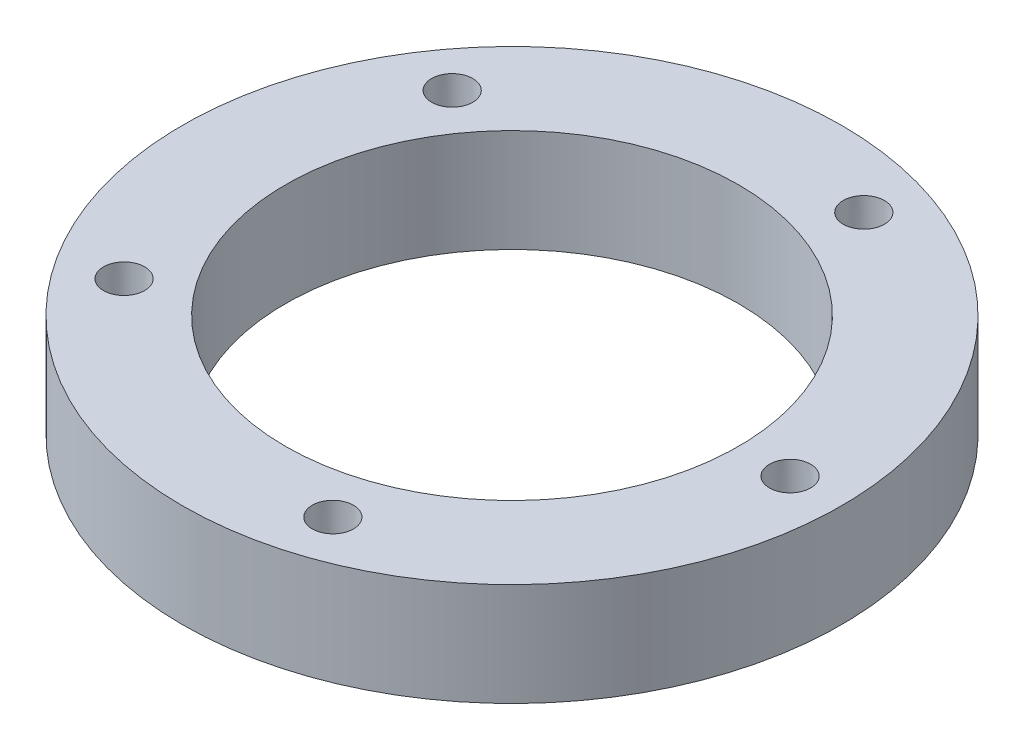
from build123d import *

# Parameters (mm, degrees)
SKETCH1_R                    = 16
SKETCH1_R_2                  = 11
BOSS_EXTRUDE2_DEPTH          = 5
SKETCH2_R                    = 1
CUT_EXTRUDE1_DEPTH           = 5
CUT_EXTRUDE1_DRAFT           = -2
CUT_EXTRUDE1_PROFILE_2_DEPTH = 5
CUT_EXTRUDE1_PROFILE_2_DRAFT = -2
CUT_EXTRUDE1_PROFILE_3_DEPTH = 5
CUT_EXTRUDE1_PROFILE_3_DRAFT = -2
CUT_EXTRUDE1_PROFILE_4_DEPTH = 5
CUT_EXTRUDE1_PROFILE_4_DRAFT = -2
CUT_EXTRUDE1_PROFILE_5_DEPTH = 5
CUT_EXTRUDE1_PROFILE_5_DRAFT = -2


with BuildPart() as part:
    # Sketch1 → Boss-Extrude2 (new body)
    with BuildSketch(Plane(origin=(0, 0, 0), x_dir=(1, 0, 0), z_dir=(0, 1, 0))):
        with Locations(Location((0, 0, 0), (0, 0, 270))):
            Circle(SKETCH1_R)
        with Locations(Location((0, 0, 0), (0, 0, 270))):
            Circle(SKETCH1_R_2, mode=Mode.SUBTRACT)
    extrude(amount=BOSS_EXTRUDE2_DEPTH)


with BuildPart() as cut_extrude1_tool:
    # Sketch2 → Cut-Extrude1 (with draft: the straight prism first)
    with BuildSketch(Plane(origin=(0, 5, 0), x_dir=(1, 0, 0), z_dir=(0, 1, 0))):
        with Locations((-10.918529424, 8.01503688)):
            Circle(SKETCH2_R)
    extrude(amount=-CUT_EXTRUDE1_DEPTH)
    # Cut-Extrude1: the draft: its side faces are tilted about the plane it starts from
    cut_extrude1_sides = [cut_extrude1_tool.faces().sort_by_distance(p)[0] for p in [
        (-11.918529424, 2.5, -8.01503688),
    ]]
    draft(cut_extrude1_sides, Plane(origin=(0, 5, 0), x_dir=(1, 0, 0), z_dir=(0, 1, 0)), CUT_EXTRUDE1_DRAFT)


with BuildPart() as part_1:
    add(part.part)

    # Cut-Extrude1: cut by cut_extrude1_tool
    add(cut_extrude1_tool.part, mode=Mode.SUBTRACT)


with BuildPart() as cut_extrude1_profile_2_tool:
    # Sketch2 → Cut-Extrude1 profile 2 (with draft: the straight prism first)
    with BuildSketch(Plane(origin=(0, 5, 0), x_dir=(1, 0, 0), z_dir=(0, 1, 0))):
        with Locations((-10.966125757, -7.868550431)):
            Circle(SKETCH2_R)
    extrude(amount=-CUT_EXTRUDE1_PROFILE_2_DEPTH)
    # Cut-Extrude1 profile 2: the draft: its side faces are tilted about the plane it starts from
    cut_extrude1_profile_2_sides = [cut_extrude1_profile_2_tool.faces().sort_by_distance(p)[0] for p in [
        (-11.966125757, 2.5, 7.868550431),
    ]]
    draft(cut_extrude1_profile_2_sides, Plane(origin=(0, 5, 0), x_dir=(1, 0, 0), z_dir=(0, 1, 0)), CUT_EXTRUDE1_PROFILE_2_DRAFT)


with BuildPart() as part_2:
    add(part_1.part)

    # Cut-Extrude1 profile 2: cut by cut_extrude1_profile_2_tool
    add(cut_extrude1_profile_2_tool.part, mode=Mode.SUBTRACT)


with BuildPart() as cut_extrude1_profile_3_tool:
    # Sketch2 → Cut-Extrude1 profile 3 (with draft: the straight prism first)
    with BuildSketch(Plane(origin=(0, 5, 0), x_dir=(1, 0, 0), z_dir=(0, 1, 0))):
        with Locations((4.125355383, -12.822115645)):
            Circle(SKETCH2_R)
    extrude(amount=-CUT_EXTRUDE1_PROFILE_3_DEPTH)
    # Cut-Extrude1 profile 3: the draft: its side faces are tilted about the plane it starts from
    cut_extrude1_profile_3_sides = [cut_extrude1_profile_3_tool.faces().sort_by_distance(p)[0] for p in [
        (3.125355383, 2.5, 12.822115645),
    ]]
    draft(cut_extrude1_profile_3_sides, Plane(origin=(0, 5, 0), x_dir=(1, 0, 0), z_dir=(0, 1, 0)), CUT_EXTRUDE1_PROFILE_3_DRAFT)


with BuildPart() as part_3:
    add(part_2.part)

    # Cut-Extrude1 profile 3: cut by cut_extrude1_profile_3_tool
    add(cut_extrude1_profile_3_tool.part, mode=Mode.SUBTRACT)


with BuildPart() as cut_extrude1_profile_4_tool:
    # Sketch2 → Cut-Extrude1 profile 4 (with draft: the straight prism first)
    with BuildSketch(Plane(origin=(0, 5, 0), x_dir=(1, 0, 0), z_dir=(0, 1, 0))):
        with Locations((13.5, 0)):
            Circle(SKETCH2_R)
    extrude(amount=-CUT_EXTRUDE1_PROFILE_4_DEPTH)
    # Cut-Extrude1 profile 4: the draft: its side faces are tilted about the plane it starts from
    cut_extrude1_profile_4_sides = [cut_extrude1_profile_4_tool.faces().sort_by_distance(p)[0] for p in [
        (12.5, 2.5, 0),
    ]]
    draft(cut_extrude1_profile_4_sides, Plane(origin=(0, 5, 0), x_dir=(1, 0, 0), z_dir=(0, 1, 0)), CUT_EXTRUDE1_PROFILE_4_DRAFT)


with BuildPart() as part_4:
    add(part_3.part)

    # Cut-Extrude1 profile 4: cut by cut_extrude1_profile_4_tool
    add(cut_extrude1_profile_4_tool.part, mode=Mode.SUBTRACT)


with BuildPart() as cut_extrude1_profile_5_tool:
    # Sketch2 → Cut-Extrude1 profile 5 (with draft: the straight prism first)
    with BuildSketch(Plane(origin=(0, 5, 0), x_dir=(1, 0, 0), z_dir=(0, 1, 0))):
        with Locations((4.202367867, 12.878068489)):
            Circle(SKETCH2_R)
    extrude(amount=-CUT_EXTRUDE1_PROFILE_5_DEPTH)
    # Cut-Extrude1 profile 5: the draft: its side faces are tilted about the plane it starts from
    cut_extrude1_profile_5_sides = [cut_extrude1_profile_5_tool.faces().sort_by_distance(p)[0] for p in [
        (3.202367867, 2.5, -12.878068489),
    ]]
    draft(cut_extrude1_profile_5_sides, Plane(origin=(0, 5, 0), x_dir=(1, 0, 0), z_dir=(0, 1, 0)), CUT_EXTRUDE1_PROFILE_5_DRAFT)


with BuildPart() as part_5:
    add(part_4.part)

    # Cut-Extrude1 profile 5: cut by cut_extrude1_profile_5_tool
    add(cut_extrude1_profile_5_tool.part, mode=Mode.SUBTRACT)


solid = part_5.part
